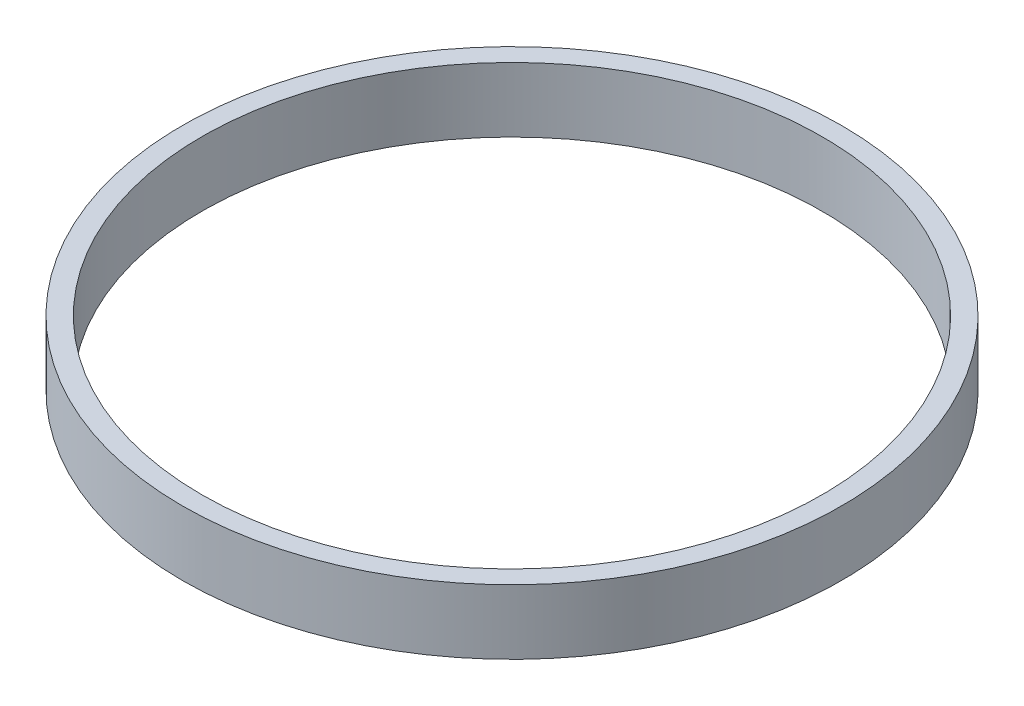
from build123d import *

# Parameters (mm, degrees)
SKETCH1_R           = 25.5
SKETCH1_R_2         = 24
BOSS_EXTRUDE1_DEPTH = 5


with BuildPart() as part:
    # Sketch1 → Boss-Extrude1 (new body)
    with BuildSketch(Plane(origin=(0, 0, 0), x_dir=(1, 0, 0), z_dir=(0, 1, 0))):
        with Locations(Location((0, 0, 0), (0, 0, 270))):
            Circle(SKETCH1_R)
        with Locations(Location((0, 0, 0), (0, 0, 270))):
            Circle(SKETCH1_R_2, mode=Mode.SUBTRACT)
    extrude(amount=BOSS_EXTRUDE1_DEPTH)


solid = part.part
